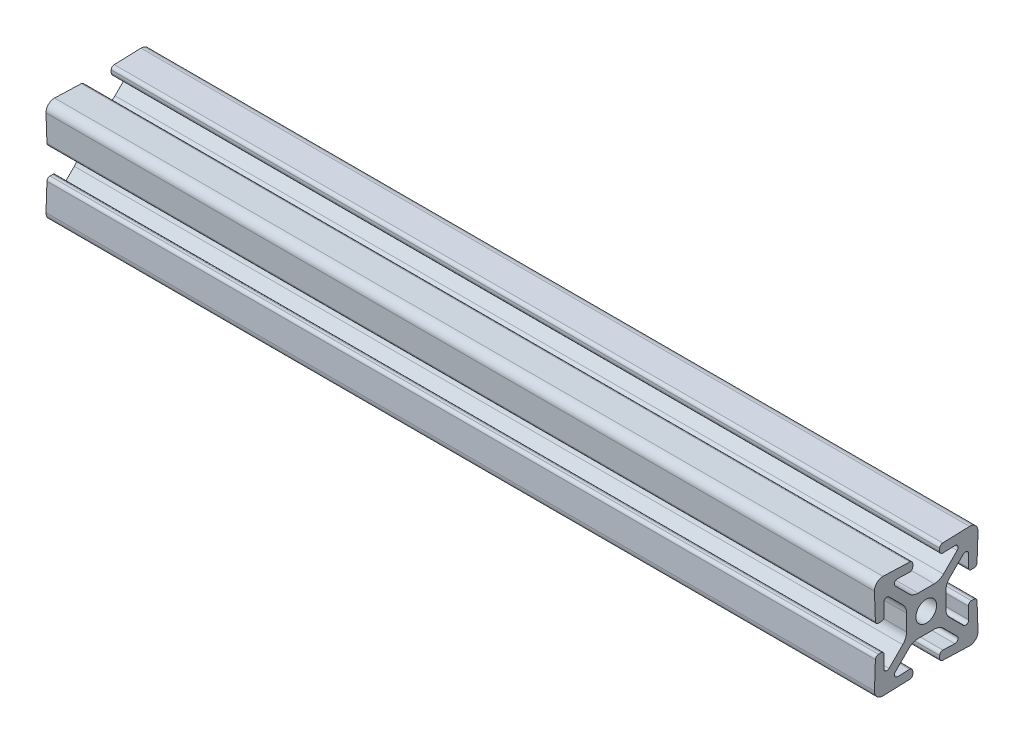
from build123d import *

# Parameters (mm, degrees)
BOSS_EXTRUDE1_DEPTH      = 101.6
BOSS_EXTRUDE1_DEPTH_BACK = 101.6


with BuildPart() as part:
    # Sketch3 → Boss-Extrude1 (new, two sides: drawn at the far end of the back side and taken through both)
    with BuildSketch(Plane(origin=(0, 0, 0), x_dir=(0, 0, -1), z_dir=(1, 0, 0)).offset(-BOSS_EXTRUDE1_DEPTH_BACK)):
        with BuildLine():
            Line((0, 4.826), (1.984228399, 4.826))
            ThreePointArc((1.984228399, 4.826), (3.199248297, 5.067682484), (4.229292429, 5.75593597))
            Line((4.229292429, 5.75593597), (7.586577723, 9.113221264))
            ThreePointArc((7.586577723, 9.113221264), (7.746562132, 9.955883421), (7.021168939, 10.413572441))
            Line((7.021168939, 10.413572441), (4.090593416, 10.311234489))
            ThreePointArc((4.090593416, 10.311234489), (3.534670322, 10.524633371), (3.302, 11.072770299))
            Line((3.302, 11.072770299), (3.302, 11.70815736))
            ThreePointArc((3.302, 11.70815736), (3.515863072, 12.237487038), (4.037406584, 12.46969317))
            Line((4.037406584, 12.46969317), (10.597084223, 12.698762161))
            ThreePointArc((10.597084223, 12.698762161), (12.104840979, 12.104840979), (12.698762161, 10.597084223))
            Line((12.698762161, 10.597084223), (12.46969317, 4.037406584))
            ThreePointArc((12.46969317, 4.037406584), (12.237487038, 3.515863072), (11.70815736, 3.302))
            Line((11.70815736, 3.302), (11.072770299, 3.302))
            ThreePointArc((11.072770299, 3.302), (10.524633371, 3.534670322), (10.311234489, 4.090593416))
            Line((10.311234489, 4.090593416), (10.413572441, 7.021168939))
            ThreePointArc((10.413572441, 7.021168939), (9.955883421, 7.746562132), (9.113221264, 7.586577723))
            Line((9.113221264, 7.586577723), (5.75593597, 4.229292429))
            ThreePointArc((5.75593597, 4.229292429), (5.067682484, 3.199248297), (4.826, 1.984228399))
            Line((4.826, 1.984228399), (4.826, 0))
            Line((4.826, 0), (2.54, 0))
            ThreePointArc((2.54, 0), (1.796051224, 1.796051224), (0, 2.54))
            Line((0, 2.54), (0, 4.826))
        make_face()
    extrude(amount=BOSS_EXTRUDE1_DEPTH + BOSS_EXTRUDE1_DEPTH_BACK)

    # Mirror1: part across plane


with BuildPart() as part_1:
    add(part.part)
    add(part.part.mirror(Plane.ZX))

    # Mirror2: part across plane


with BuildPart() as part_2:
    add(part_1.part)
    add(part_1.part.mirror(Plane.XY))


solid = part_2.part
